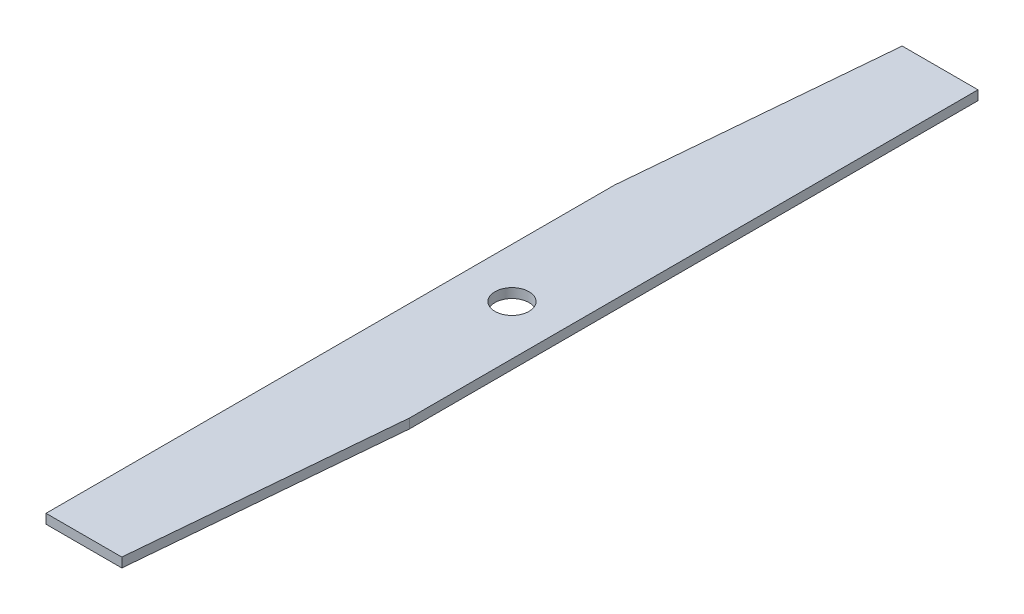
from build123d import *

# Parameters (mm, degrees)
SKETCH1_R           = 5.715
BOSS_EXTRUDE1_DEPTH = 3.175


with BuildPart() as part:
    # Sketch1 → Boss-Extrude1 (new body)
    with BuildSketch(Plane(origin=(0, 0, 0), x_dir=(1, 0, 0), z_dir=(0, 1, 0))):
        Polygon((0, 0), (0, 190.5), (7.848149628, 279.052902535), (33.248149628, 279.052902535), (33.248149628, 88.552902535), (25.4, 0), align=None)
        with Locations(Location((16.624074814, 139.526451268, 0), (0, 0, 270))):
            Circle(SKETCH1_R, mode=Mode.SUBTRACT)
    extrude(amount=BOSS_EXTRUDE1_DEPTH)


solid = part.part
